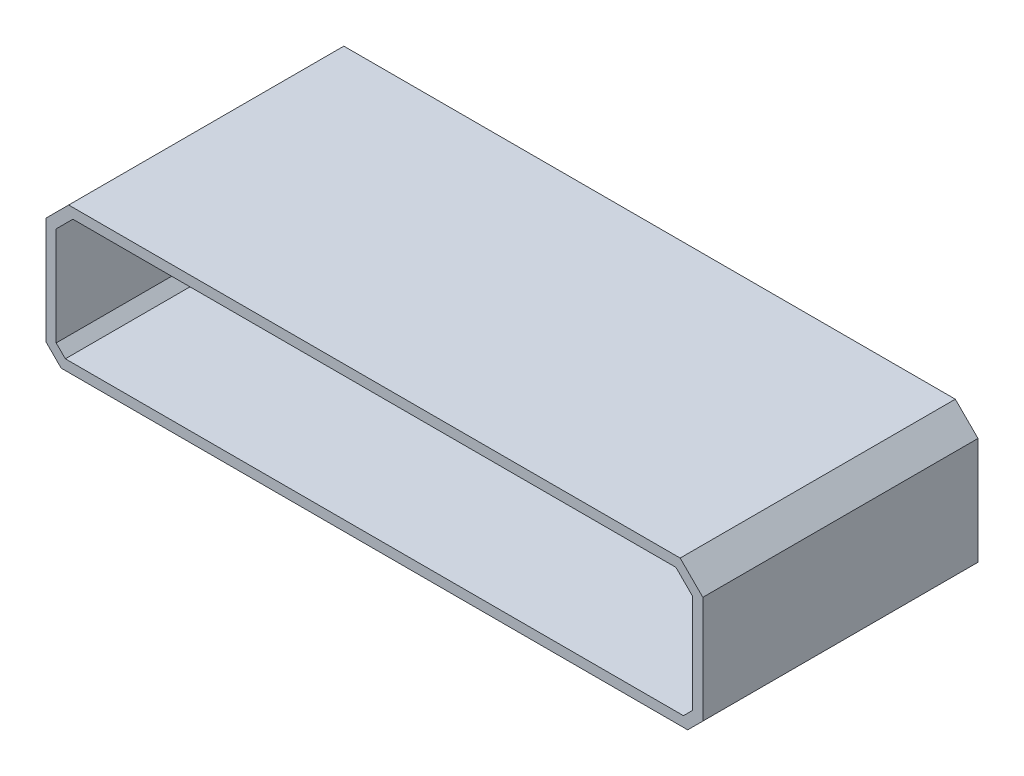
from build123d import *

# Parameters (mm, degrees)
BOSS_EXTRUDE1_DEPTH = 685.8


with BuildPart() as part:
    # Sketch1 → Boss-Extrude1 (new body)
    with BuildSketch(Plane.XY):
        Polygon((762, 0), (-762, 0), (-818.489894307, -56.489894307), (-818.489894307, -323.748806026), (-780.75084727, -361.487853063), (780.75084727, -361.487853063), (818.489894307, -323.748806026), (818.489894307, -56.489894307), align=None)
        Polygon((751.478975516, -25.4), (-751.478975516, -25.4), (-793.089894307, -67.010918791), (-793.089894307, -313.227781542), (-770.229822786, -336.087853063), (770.229822786, -336.087853063), (793.089894307, -313.227781542), (793.089894307, -67.010918791), align=None, mode=Mode.SUBTRACT)
    extrude(amount=BOSS_EXTRUDE1_DEPTH)


solid = part.part
